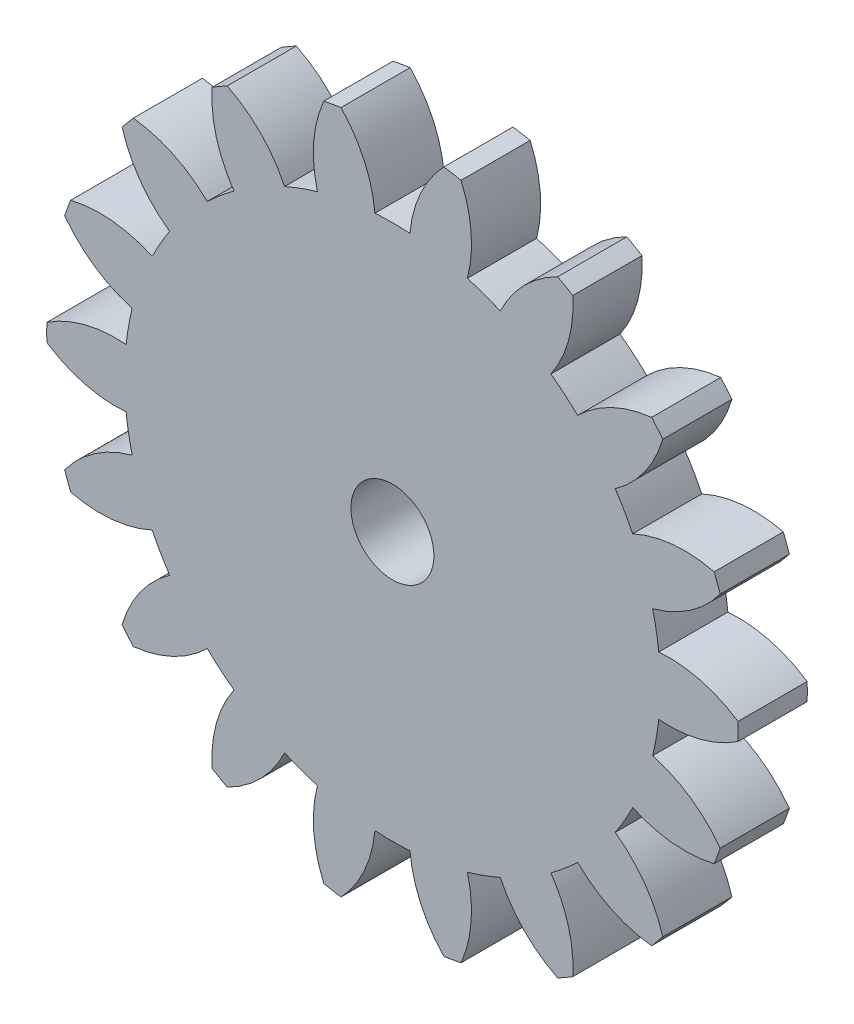
from build123d import *

# Parameters (mm, degrees)
SKETCH1_R           = 3
BOSS_EXTRUDE2_DEPTH = 5


with BuildPart() as part:
    # Sketch1 → Boss-Extrude2 (new body)
    with BuildSketch(Plane.XY):
        with BuildLine():
            ThreePointArc((-19.550519413, 15.581309017), (-18.238129642, 12.880402273), (-16.110253623, 10.761580005))
            ThreePointArc((-16.110253623, 10.761580005), (-16.778376173, 9.687), (-17.374928481, 8.571098896))
            ThreePointArc((-17.374928481, 8.571098896), (-20.2738204, 9.354482451), (-23.269069139, 9.14059196))
            ThreePointArc((-23.269069139, 9.14059196), (-23.49231552, 8.550503583), (-23.700600368, 7.954969654))
            ThreePointArc((-23.700600368, 7.954969654), (-21.543592873, 5.865811255), (-18.819363584, 4.602546066))
            ThreePointArc((-18.819363584, 4.602546066), (-19.079665407, 3.364259794), (-19.258580553, 2.111622855))
            ThreePointArc((-19.258580553, 2.111622855), (-22.250580854, 1.856283171), (-24.992039135, 0.630856452))
            ThreePointArc((-24.992039135, 0.630856452), (-25, 0), (-24.992039135, -0.630856452))
            ThreePointArc((-24.992039135, -0.630856452), (-22.250580854, -1.856283171), (-19.258580553, -2.111622855))
            ThreePointArc((-19.258580553, -2.111622855), (-19.079665407, -3.364259794), (-18.819363584, -4.602546066))
            ThreePointArc((-18.819363584, -4.602546066), (-21.543592873, -5.865811255), (-23.700600368, -7.954969654))
            ThreePointArc((-23.700600368, -7.954969654), (-23.49231552, -8.550503583), (-23.269069139, -9.14059196))
            ThreePointArc((-23.269069139, -9.14059196), (-20.2738204, -9.354482451), (-17.374928481, -8.571098896))
            ThreePointArc((-17.374928481, -8.571098896), (-16.778376173, -9.687), (-16.110253623, -10.761580005))
            ThreePointArc((-16.110253623, -10.761580005), (-18.238129642, -12.880402273), (-19.550519413, -15.581309017))
            ThreePointArc((-19.550519413, -15.581309017), (-19.151111078, -16.069690242), (-18.739505991, -16.547837177))
            ThreePointArc((-18.739505991, -16.547837177), (-15.851737997, -15.724393089), (-13.395603607, -13.996773914))
            ThreePointArc((-13.395603607, -13.996773914), (-12.45336715, -14.841345041), (-11.458009312, -15.622608572))
            ThreePointArc((-11.458009312, -15.622608572), (-12.73287881, -18.341426683), (-13.042357282, -21.328312557))
            ThreePointArc((-13.042357282, -21.328312557), (-12.5, -21.650635095), (-11.949681854, -21.95916901))
            ThreePointArc((-11.949681854, -21.95916901), (-9.517702044, -20.197709854), (-7.800571241, -17.734231427))
            ThreePointArc((-7.800571241, -17.734231427), (-6.626298257, -18.205604835), (-5.423759977, -18.59931998))
            ThreePointArc((-5.423759977, -18.59931998), (-5.691854876, -21.590204344), (-4.961094377, -24.502806831))
            ThreePointArc((-4.961094377, -24.502806831), (-4.341204442, -24.620193825), (-3.718549727, -24.721900977))
            ThreePointArc((-3.718549727, -24.721900977), (-2.035690758, -22.234884724), (-1.264674858, -19.332678901))
            ThreePointArc((-1.264674858, -19.332678901), (0, -19.374), (1.264674858, -19.332678901))
            ThreePointArc((1.264674858, -19.332678901), (2.035690758, -22.234884724), (3.718549727, -24.721900977))
            ThreePointArc((3.718549727, -24.721900977), (4.341204442, -24.620193825), (4.961094377, -24.502806831))
            ThreePointArc((4.961094377, -24.502806831), (5.691854876, -21.590204344), (5.423759977, -18.59931998))
            ThreePointArc((5.423759977, -18.59931998), (6.626298257, -18.205604835), (7.800571241, -17.734231427))
            ThreePointArc((7.800571241, -17.734231427), (9.517702044, -20.197709854), (11.949681854, -21.95916901))
            ThreePointArc((11.949681854, -21.95916901), (12.5, -21.650635095), (13.042357282, -21.328312557))
            ThreePointArc((13.042357282, -21.328312557), (12.73287881, -18.341426683), (11.458009312, -15.622608572))
            ThreePointArc((11.458009312, -15.622608572), (12.45336715, -14.841345041), (13.395603607, -13.996773914))
            ThreePointArc((13.395603607, -13.996773914), (15.851737997, -15.724393089), (18.739505991, -16.547837177))
            ThreePointArc((18.739505991, -16.547837177), (19.151111078, -16.069690242), (19.550519413, -15.581309017))
            ThreePointArc((19.550519413, -15.581309017), (18.238129642, -12.880402273), (16.110253623, -10.761580005))
            ThreePointArc((16.110253623, -10.761580005), (16.778376173, -9.687), (17.374928481, -8.571098896))
            ThreePointArc((17.374928481, -8.571098896), (20.2738204, -9.354482451), (23.269069139, -9.14059196))
            ThreePointArc((23.269069139, -9.14059196), (23.49231552, -8.550503583), (23.700600368, -7.954969654))
            ThreePointArc((23.700600368, -7.954969654), (21.543592873, -5.865811255), (18.819363584, -4.602546066))
            ThreePointArc((18.819363584, -4.602546066), (19.079665407, -3.364259794), (19.258580553, -2.111622855))
            ThreePointArc((19.258580553, -2.111622855), (22.250580854, -1.856283171), (24.992039135, -0.630856452))
            ThreePointArc((24.992039135, -0.630856452), (25, 0), (24.992039135, 0.630856452))
            ThreePointArc((24.992039135, 0.630856452), (22.250580854, 1.856283171), (19.258580553, 2.111622855))
            ThreePointArc((19.258580553, 2.111622855), (19.079665407, 3.364259794), (18.819363584, 4.602546066))
            ThreePointArc((18.819363584, 4.602546066), (21.543592873, 5.865811255), (23.700600368, 7.954969654))
            ThreePointArc((23.700600368, 7.954969654), (23.49231552, 8.550503583), (23.269069139, 9.14059196))
            ThreePointArc((23.269069139, 9.14059196), (20.2738204, 9.354482451), (17.374928481, 8.571098896))
            ThreePointArc((17.374928481, 8.571098896), (16.778376173, 9.687), (16.110253623, 10.761580005))
            ThreePointArc((16.110253623, 10.761580005), (18.238129642, 12.880402273), (19.550519413, 15.581309017))
            ThreePointArc((19.550519413, 15.581309017), (19.151111078, 16.069690242), (18.739505991, 16.547837177))
            ThreePointArc((18.739505991, 16.547837177), (15.851737997, 15.724393089), (13.395603607, 13.996773914))
            ThreePointArc((13.395603607, 13.996773914), (12.45336715, 14.841345041), (11.458009312, 15.622608572))
            ThreePointArc((11.458009312, 15.622608572), (12.73287881, 18.341426683), (13.042357282, 21.328312557))
            ThreePointArc((13.042357282, 21.328312557), (12.5, 21.650635095), (11.949681854, 21.95916901))
            ThreePointArc((11.949681854, 21.95916901), (9.517702044, 20.197709854), (7.800571241, 17.734231427))
            ThreePointArc((7.800571241, 17.734231427), (6.626298257, 18.205604835), (5.423759977, 18.59931998))
            ThreePointArc((5.423759977, 18.59931998), (5.691854876, 21.590204344), (4.961094377, 24.502806831))
            ThreePointArc((4.961094377, 24.502806831), (4.341204442, 24.620193825), (3.718549727, 24.721900977))
            ThreePointArc((3.718549727, 24.721900977), (2.035690758, 22.234884724), (1.264674858, 19.332678901))
            ThreePointArc((1.264674858, 19.332678901), (0, 19.374), (-1.264674858, 19.332678901))
            ThreePointArc((-1.264674858, 19.332678901), (-2.035690758, 22.234884724), (-3.718549727, 24.721900977))
            ThreePointArc((-3.718549727, 24.721900977), (-4.341204442, 24.620193825), (-4.961094377, 24.502806831))
            ThreePointArc((-4.961094377, 24.502806831), (-5.691854876, 21.590204344), (-5.423759977, 18.59931998))
            ThreePointArc((-5.423759977, 18.59931998), (-6.626298257, 18.205604835), (-7.800571241, 17.734231427))
            ThreePointArc((-7.800571241, 17.734231427), (-9.517702044, 20.197709854), (-11.949681854, 21.95916901))
            ThreePointArc((-11.949681854, 21.95916901), (-12.5, 21.650635095), (-13.042357282, 21.328312557))
            ThreePointArc((-13.042357282, 21.328312557), (-12.73287881, 18.341426683), (-11.458009312, 15.622608572))
            ThreePointArc((-11.458009312, 15.622608572), (-12.45336715, 14.841345041), (-13.395603607, 13.996773914))
            ThreePointArc((-13.395603607, 13.996773914), (-15.851737997, 15.724393089), (-18.739505991, 16.547837177))
            ThreePointArc((-18.739505991, 16.547837177), (-19.151111078, 16.069690242), (-19.550519413, 15.581309017))
        make_face()
        Circle(SKETCH1_R, mode=Mode.SUBTRACT)
    extrude(amount=BOSS_EXTRUDE2_DEPTH)


solid = part.part
